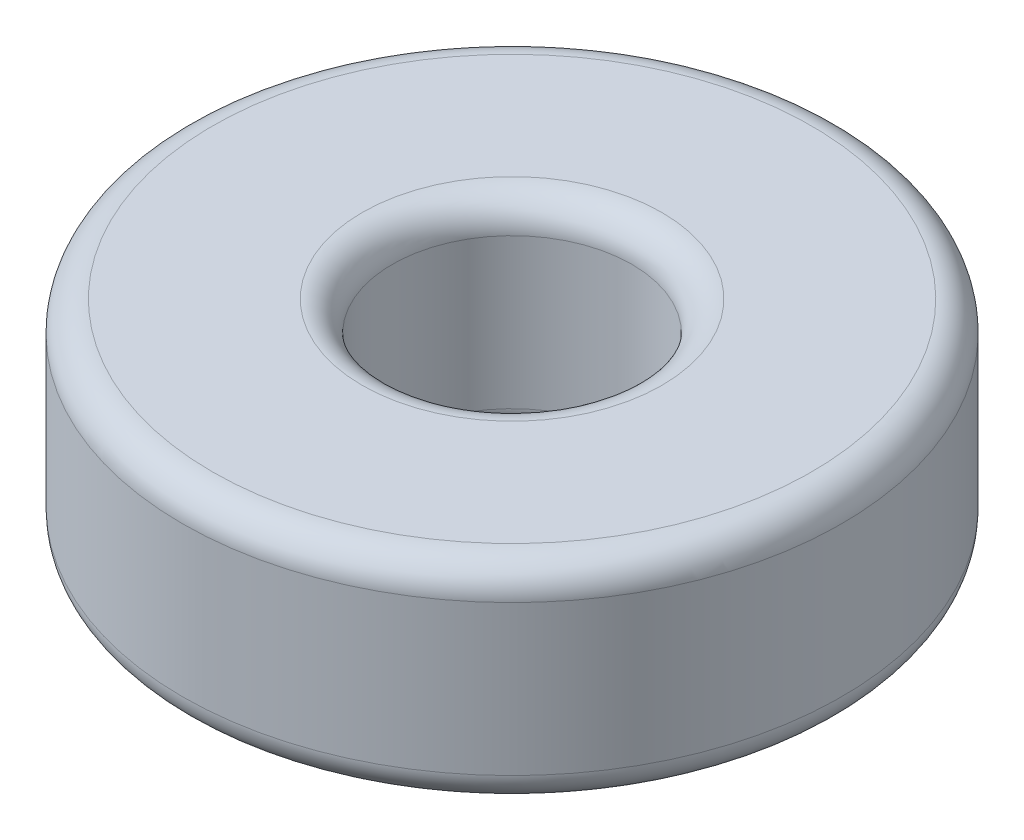
from build123d import *

# Parameters (mm, degrees)
SKETCH1_R           = 11
SKETCH1_R_2         = 4
BOSS_EXTRUDE1_DEPTH = 7
FILLET2_R           = 1


with BuildPart() as part:
    # Sketch1 → Boss-Extrude1 (new body)
    with BuildSketch(Plane(origin=(0, 0, 0), x_dir=(1, 0, 0), z_dir=(0, 1, 0))):
        with Locations(Location((0, 0, 0), (0, 0, 270))):
            Circle(SKETCH1_R)
        with Locations(Location((0, 0, 0), (0, 0, 270))):
            Circle(SKETCH1_R_2, mode=Mode.SUBTRACT)
    extrude(amount=BOSS_EXTRUDE1_DEPTH)

    # Fillet2
    fillet2_edges = [part.edges().sort_by_distance(p)[0] for p in [
        (0, 0, -11),
        (0, 7, -11),
        (0, 0, -4),
        (0, 7, -4),
    ]]
    fillet(fillet2_edges, radius=FILLET2_R)


solid = part.part
